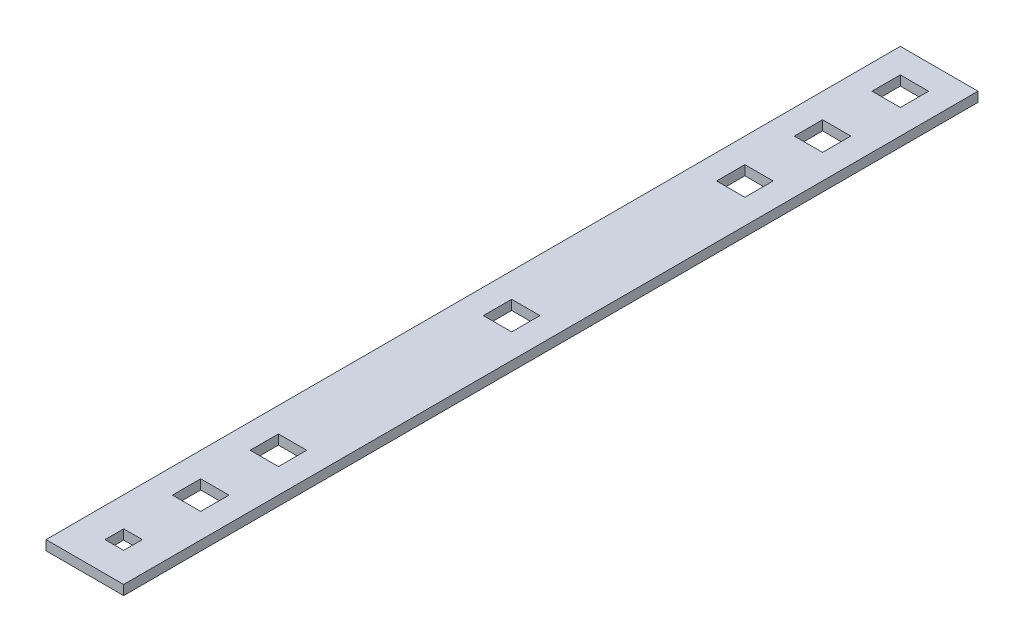
from build123d import *

# Parameters (mm, degrees)
SKETCH1_W           = 12.7
SKETCH1_H           = 139.7
SKETCH1_W_2         = 4.6228
SKETCH1_H_2         = 4.6228
SKETCH1_W_3         = 3.048
SKETCH1_H_3         = 3.048
BOSS_EXTRUDE1_DEPTH = 1.5875


with BuildPart() as part:
    # Sketch1 → Boss-Extrude1 (new body)
    with BuildSketch(Plane(origin=(0, 0, 0), x_dir=(1, 0, 0), z_dir=(0, 1, 0))):
        with Locations((6.312912156, 31.687542426)):
            Rectangle(SKETCH1_W, SKETCH1_H)
        with Locations((6.311512156, 95.186142426)):
            Rectangle(SKETCH1_W_2, SKETCH1_H_2, mode=Mode.SUBTRACT)
        with Locations((6.311512156, 82.474863648)):
            Rectangle(SKETCH1_W_2, SKETCH1_H_2, mode=Mode.SUBTRACT)
        with Locations((6.311512156, 69.763584871)):
            Rectangle(SKETCH1_W_2, SKETCH1_H_2, mode=Mode.SUBTRACT)
        with Locations((6.313912156, -31.813457574)):
            Rectangle(SKETCH1_W_3, SKETCH1_H_3, mode=Mode.SUBTRACT)
        with Locations((6.311512156, 31.629748538)):
            Rectangle(SKETCH1_W_2, SKETCH1_H_2, mode=Mode.SUBTRACT)
        with Locations((6.311512156, -6.504087794)):
            Rectangle(SKETCH1_W_2, SKETCH1_H_2, mode=Mode.SUBTRACT)
        with Locations((6.311512156, -19.215366572)):
            Rectangle(SKETCH1_W_2, SKETCH1_H_2, mode=Mode.SUBTRACT)
    extrude(amount=BOSS_EXTRUDE1_DEPTH)


solid = part.part
